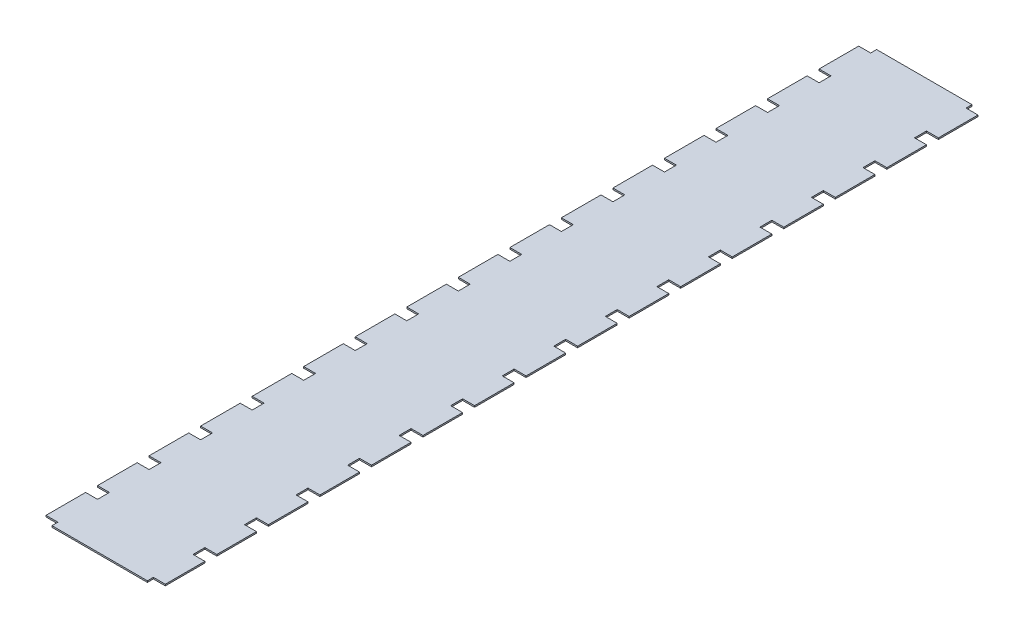
from build123d import *

# Parameters (mm, degrees)
SKETCH1_W                  = 127
SKETCH1_H                  = 877.824
BOSS_EXTRUDE1_DEPTH        = 1.5875
SKETCH2_W                  = 12.7
SKETCH2_H                  = 6.35
CUT_EXTRUDE1_DEPTH         = 444.48451371
SKETCH3_W                  = 12.7
SKETCH3_H                  = 12.7
CUT_EXTRUDE2_DEPTH         = 444.48451371
LPATTERN1_COUNT            = 15
LPATTERN1_PITCH            = 54.864
LPATTERN1_COPY_1_SKETCH_W  = 12.7
LPATTERN1_COPY_1_SKETCH_H  = 12.7
LPATTERN1_COPY_1_DEPTH     = 444.48451371
LPATTERN1_COPY_2_SKETCH_W  = 12.7
LPATTERN1_COPY_2_SKETCH_H  = 12.7
LPATTERN1_COPY_2_DEPTH     = 444.48451371
LPATTERN1_COPY_3_SKETCH_W  = 12.7
LPATTERN1_COPY_3_SKETCH_H  = 12.7
LPATTERN1_COPY_3_DEPTH     = 444.48451371
LPATTERN1_COPY_4_SKETCH_W  = 12.7
LPATTERN1_COPY_4_SKETCH_H  = 12.7
LPATTERN1_COPY_4_DEPTH     = 444.48451371
LPATTERN1_COPY_5_SKETCH_W  = 12.7
LPATTERN1_COPY_5_SKETCH_H  = 12.7
LPATTERN1_COPY_5_DEPTH     = 444.48451371
LPATTERN1_COPY_6_SKETCH_W  = 12.7
LPATTERN1_COPY_6_SKETCH_H  = 12.7
LPATTERN1_COPY_6_DEPTH     = 444.48451371
LPATTERN1_COPY_7_SKETCH_W  = 12.7
LPATTERN1_COPY_7_SKETCH_H  = 12.7
LPATTERN1_COPY_7_DEPTH     = 444.48451371
LPATTERN1_COPY_8_SKETCH_W  = 12.7
LPATTERN1_COPY_8_SKETCH_H  = 12.7
LPATTERN1_COPY_8_DEPTH     = 444.48451371
LPATTERN1_COPY_9_SKETCH_W  = 12.7
LPATTERN1_COPY_9_SKETCH_H  = 12.7
LPATTERN1_COPY_9_DEPTH     = 444.48451371
LPATTERN1_COPY_10_SKETCH_W = 12.7
LPATTERN1_COPY_10_SKETCH_H = 12.7
LPATTERN1_COPY_10_DEPTH    = 444.48451371
LPATTERN1_COPY_11_SKETCH_W = 12.7
LPATTERN1_COPY_11_SKETCH_H = 12.7
LPATTERN1_COPY_11_DEPTH    = 444.48451371
LPATTERN1_COPY_12_SKETCH_W = 12.7
LPATTERN1_COPY_12_SKETCH_H = 12.7
LPATTERN1_COPY_12_DEPTH    = 444.48451371
LPATTERN1_COPY_13_SKETCH_W = 12.7
LPATTERN1_COPY_13_SKETCH_H = 12.7
LPATTERN1_COPY_13_DEPTH    = 444.48451371
LPATTERN1_COPY_14_SKETCH_W = 12.7
LPATTERN1_COPY_14_SKETCH_H = 12.7
LPATTERN1_COPY_14_DEPTH    = 444.48451371


with BuildPart() as part:
    # Sketch1 → Boss-Extrude1 (new body)
    with BuildSketch(Plane(origin=(0, 0, 0), x_dir=(1, 0, 0), z_dir=(0, 1, 0))):
        Rectangle(SKETCH1_W, SKETCH1_H)
    extrude(amount=BOSS_EXTRUDE1_DEPTH)

    # Sketch2 → Cut-Extrude1 (cut, through all)
    with BuildSketch(Plane(origin=(0, 1.5875, 0), x_dir=(1, 0, 0), z_dir=(0, 1, 0))):
        with Locations((-57.15, 435.737)):
            Rectangle(SKETCH2_W, SKETCH2_H)
        with Locations((57.15, 435.737)):
            Rectangle(SKETCH2_W, SKETCH2_H)
    cut_extrude1 = extrude(amount=-CUT_EXTRUDE1_DEPTH, mode=Mode.SUBTRACT)

    # Mirror1: Cut-Extrude1 across plane
    add(cut_extrude1.mirror(Plane.XY), mode=Mode.SUBTRACT)

    # Sketch3 → Cut-Extrude2 (cut, through all)
    with BuildSketch(Plane(origin=(0, 1.5875, 0), x_dir=(1, 0, 0), z_dir=(0, 1, 0))):
        with Locations((-57.15, 384.048)):
            Rectangle(SKETCH3_W, SKETCH3_H)
    cut_extrude2 = extrude(amount=-CUT_EXTRUDE2_DEPTH, mode=Mode.SUBTRACT)

    # Mirror2: Cut-Extrude2 across plane
    add(cut_extrude2.mirror(Plane(origin=(0, 0, 0), x_dir=(0, 0, 1), z_dir=(1, 0, 0))), mode=Mode.SUBTRACT)

    # LPattern1: Cut-Extrude2 ×15
    with Locations(*[(0, 0, i * LPATTERN1_PITCH) for i in range(1, LPATTERN1_COUNT)]):
        add(cut_extrude2, mode=Mode.SUBTRACT)

    # LPattern1 copy 1 sketch → LPattern1 copy 1 (cut, through all)
    with BuildSketch(Plane(origin=(0, 1.5875, 54.864), x_dir=(-1, 0, 0), z_dir=(0, 1, 0))):
        with Locations((-57.15, -384.048)):
            Rectangle(LPATTERN1_COPY_1_SKETCH_W, LPATTERN1_COPY_1_SKETCH_H)
    extrude(amount=-LPATTERN1_COPY_1_DEPTH, mode=Mode.SUBTRACT)

    # LPattern1 copy 2 sketch → LPattern1 copy 2 (cut, through all)
    with BuildSketch(Plane(origin=(0, 1.5875, 109.728), x_dir=(-1, 0, 0), z_dir=(0, 1, 0))):
        with Locations((-57.15, -384.048)):
            Rectangle(LPATTERN1_COPY_2_SKETCH_W, LPATTERN1_COPY_2_SKETCH_H)
    extrude(amount=-LPATTERN1_COPY_2_DEPTH, mode=Mode.SUBTRACT)

    # LPattern1 copy 3 sketch → LPattern1 copy 3 (cut, through all)
    with BuildSketch(Plane(origin=(0, 1.5875, 164.592), x_dir=(-1, 0, 0), z_dir=(0, 1, 0))):
        with Locations((-57.15, -384.048)):
            Rectangle(LPATTERN1_COPY_3_SKETCH_W, LPATTERN1_COPY_3_SKETCH_H)
    extrude(amount=-LPATTERN1_COPY_3_DEPTH, mode=Mode.SUBTRACT)

    # LPattern1 copy 4 sketch → LPattern1 copy 4 (cut, through all)
    with BuildSketch(Plane(origin=(0, 1.5875, 219.456), x_dir=(-1, 0, 0), z_dir=(0, 1, 0))):
        with Locations((-57.15, -384.048)):
            Rectangle(LPATTERN1_COPY_4_SKETCH_W, LPATTERN1_COPY_4_SKETCH_H)
    extrude(amount=-LPATTERN1_COPY_4_DEPTH, mode=Mode.SUBTRACT)

    # LPattern1 copy 5 sketch → LPattern1 copy 5 (cut, through all)
    with BuildSketch(Plane(origin=(0, 1.5875, 274.32), x_dir=(-1, 0, 0), z_dir=(0, 1, 0))):
        with Locations((-57.15, -384.048)):
            Rectangle(LPATTERN1_COPY_5_SKETCH_W, LPATTERN1_COPY_5_SKETCH_H)
    extrude(amount=-LPATTERN1_COPY_5_DEPTH, mode=Mode.SUBTRACT)

    # LPattern1 copy 6 sketch → LPattern1 copy 6 (cut, through all)
    with BuildSketch(Plane(origin=(0, 1.5875, 329.184), x_dir=(-1, 0, 0), z_dir=(0, 1, 0))):
        with Locations((-57.15, -384.048)):
            Rectangle(LPATTERN1_COPY_6_SKETCH_W, LPATTERN1_COPY_6_SKETCH_H)
    extrude(amount=-LPATTERN1_COPY_6_DEPTH, mode=Mode.SUBTRACT)

    # LPattern1 copy 7 sketch → LPattern1 copy 7 (cut, through all)
    with BuildSketch(Plane(origin=(0, 1.5875, 384.048), x_dir=(-1, 0, 0), z_dir=(0, 1, 0))):
        with Locations((-57.15, -384.048)):
            Rectangle(LPATTERN1_COPY_7_SKETCH_W, LPATTERN1_COPY_7_SKETCH_H)
    extrude(amount=-LPATTERN1_COPY_7_DEPTH, mode=Mode.SUBTRACT)

    # LPattern1 copy 8 sketch → LPattern1 copy 8 (cut, through all)
    with BuildSketch(Plane(origin=(0, 1.5875, 438.912), x_dir=(-1, 0, 0), z_dir=(0, 1, 0))):
        with Locations((-57.15, -384.048)):
            Rectangle(LPATTERN1_COPY_8_SKETCH_W, LPATTERN1_COPY_8_SKETCH_H)
    extrude(amount=-LPATTERN1_COPY_8_DEPTH, mode=Mode.SUBTRACT)

    # LPattern1 copy 9 sketch → LPattern1 copy 9 (cut, through all)
    with BuildSketch(Plane(origin=(0, 1.5875, 493.776), x_dir=(-1, 0, 0), z_dir=(0, 1, 0))):
        with Locations((-57.15, -384.048)):
            Rectangle(LPATTERN1_COPY_9_SKETCH_W, LPATTERN1_COPY_9_SKETCH_H)
    extrude(amount=-LPATTERN1_COPY_9_DEPTH, mode=Mode.SUBTRACT)

    # LPattern1 copy 10 sketch → LPattern1 copy 10 (cut, through all)
    with BuildSketch(Plane(origin=(0, 1.5875, 548.64), x_dir=(-1, 0, 0), z_dir=(0, 1, 0))):
        with Locations((-57.15, -384.048)):
            Rectangle(LPATTERN1_COPY_10_SKETCH_W, LPATTERN1_COPY_10_SKETCH_H)
    extrude(amount=-LPATTERN1_COPY_10_DEPTH, mode=Mode.SUBTRACT)

    # LPattern1 copy 11 sketch → LPattern1 copy 11 (cut, through all)
    with BuildSketch(Plane(origin=(0, 1.5875, 603.504), x_dir=(-1, 0, 0), z_dir=(0, 1, 0))):
        with Locations((-57.15, -384.048)):
            Rectangle(LPATTERN1_COPY_11_SKETCH_W, LPATTERN1_COPY_11_SKETCH_H)
    extrude(amount=-LPATTERN1_COPY_11_DEPTH, mode=Mode.SUBTRACT)

    # LPattern1 copy 12 sketch → LPattern1 copy 12 (cut, through all)
    with BuildSketch(Plane(origin=(0, 1.5875, 658.368), x_dir=(-1, 0, 0), z_dir=(0, 1, 0))):
        with Locations((-57.15, -384.048)):
            Rectangle(LPATTERN1_COPY_12_SKETCH_W, LPATTERN1_COPY_12_SKETCH_H)
    extrude(amount=-LPATTERN1_COPY_12_DEPTH, mode=Mode.SUBTRACT)

    # LPattern1 copy 13 sketch → LPattern1 copy 13 (cut, through all)
    with BuildSketch(Plane(origin=(0, 1.5875, 713.232), x_dir=(-1, 0, 0), z_dir=(0, 1, 0))):
        with Locations((-57.15, -384.048)):
            Rectangle(LPATTERN1_COPY_13_SKETCH_W, LPATTERN1_COPY_13_SKETCH_H)
    extrude(amount=-LPATTERN1_COPY_13_DEPTH, mode=Mode.SUBTRACT)

    # LPattern1 copy 14 sketch → LPattern1 copy 14 (cut, through all)
    with BuildSketch(Plane(origin=(0, 1.5875, 768.096), x_dir=(-1, 0, 0), z_dir=(0, 1, 0))):
        with Locations((-57.15, -384.048)):
            Rectangle(LPATTERN1_COPY_14_SKETCH_W, LPATTERN1_COPY_14_SKETCH_H)
    extrude(amount=-LPATTERN1_COPY_14_DEPTH, mode=Mode.SUBTRACT)


solid = part.part
